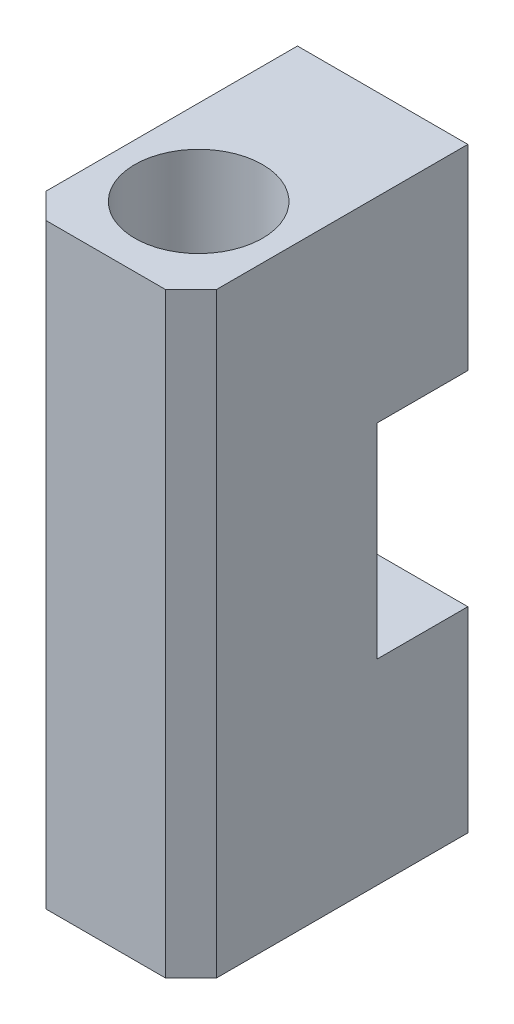
from build123d import *

# Parameters (mm, degrees)
SCHIZZO1_W                   = 20
SCHIZZO1_H                   = 70
ESTRUSIONE_ESTRUSIONE1_DEPTH = 32.5
SCHIZZO2_R                   = 7.5
TAGLIO_ESTRUSIONE1_DEPTH     = 80.726093596
FORO_4_0_4_1_D               = 4
FORO_4_0_4_1_DEPTH           = 10
FORO_4_0_4_1_TIP             = 1.201721238
SMUSSO1_SIZE                 = 3
SCHIZZO7_W                   = 10.645993212
SCHIZZO7_H                   = 24
TAGLIO_ESTRUSIONE4_DEPTH     = 26


with BuildPart() as part:
    # Schizzo1 → Estrusione-Estrusione1 (new body)
    with BuildSketch(Plane.XY):
        with Locations((10, 35)):
            Rectangle(SCHIZZO1_W, SCHIZZO1_H)
    extrude(amount=-ESTRUSIONE_ESTRUSIONE1_DEPTH)

    # Schizzo2 → Taglio-Estrusione1 (cut, through all)
    with BuildSketch(Plane.XZ):
        with Locations((10, -10.9)):
            Circle(SCHIZZO2_R)
    extrude(amount=-TAGLIO_ESTRUSIONE1_DEPTH, mode=Mode.SUBTRACT)

    # Foro Ø4.0 (4)-1
    with Locations(Plane(origin=(10, 6, -32.5), x_dir=(-1, 0, 0), z_dir=(0, 0, -1))):
        with Locations((0, 0), (0, 58)):
            Hole(FORO_4_0_4_1_D / 2, depth=FORO_4_0_4_1_DEPTH)
            with Locations((0, 0, -(FORO_4_0_4_1_DEPTH + FORO_4_0_4_1_TIP / 2))):  # 118° drill point
                Cone(0, FORO_4_0_4_1_D / 2, FORO_4_0_4_1_TIP, mode=Mode.SUBTRACT)

    # Smusso1
    smusso1_edges = [part.edges().sort_by_distance(p)[0] for p in [
        (0, 35, 0),
        (20, 35, 0),
    ]]
    chamfer(smusso1_edges, length=SMUSSO1_SIZE)

    # Schizzo7 → Taglio-Estrusione4 (cut)
    with BuildSketch(Plane.ZY):
        with Locations((-27.177003394, 35)):
            Rectangle(SCHIZZO7_W, SCHIZZO7_H)
    extrude(amount=-TAGLIO_ESTRUSIONE4_DEPTH, mode=Mode.SUBTRACT)


solid = part.part
